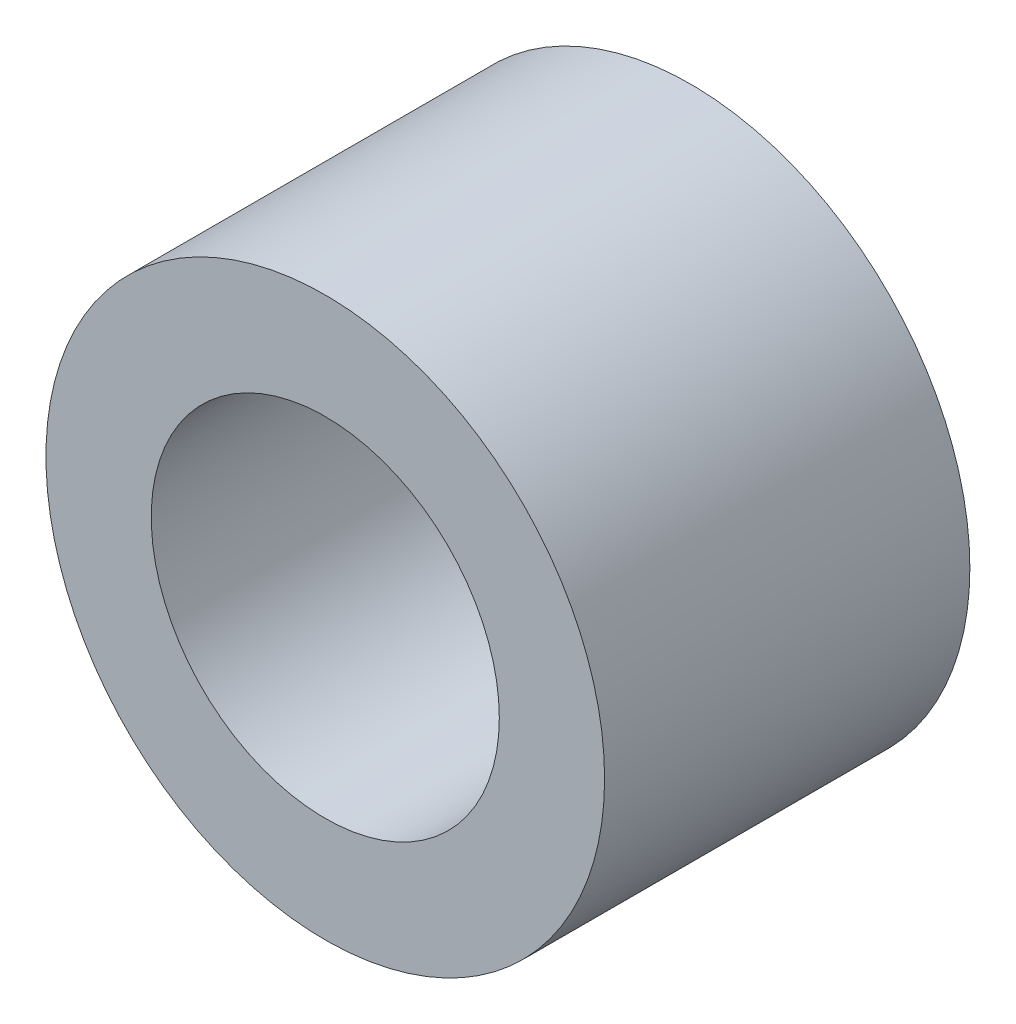
from build123d import *

# Parameters (mm, degrees)
SKETCH1_R           = 6.5
SKETCH1_R_2         = 4.05
BOSS_EXTRUDE1_DEPTH = 4.25


with BuildPart() as part:
    # Sketch1 → Boss-Extrude1 (new, symmetric)
    with BuildSketch(Plane.XY):
        Circle(SKETCH1_R)
        Circle(SKETCH1_R_2, mode=Mode.SUBTRACT)
    extrude(amount=BOSS_EXTRUDE1_DEPTH, both=True)


solid = part.part
